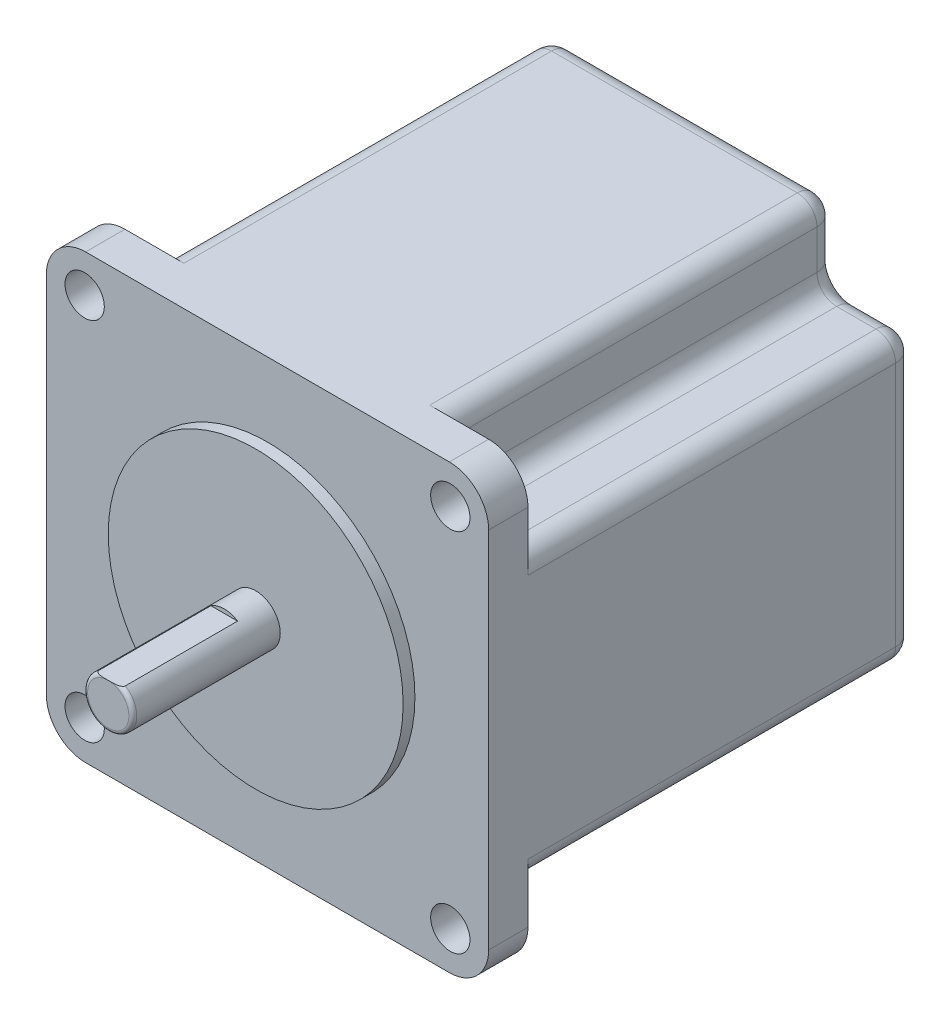
from build123d import *

# Parameters (mm, degrees)
SKETCH1_W           = 57.15
SKETCH1_H           = 57.15
BOSS_EXTRUDE1_DEPTH = 55.118
SKETCH2_R           = 19.05
BOSS_EXTRUDE2_DEPTH = 1.524
SKETCH3_R           = 3.175
BOSS_EXTRUDE3_DEPTH = 19.05
SKETCH18_W          = 20.32
SKETCH18_H          = 20.32
CUT_EXTRUDE13_DEPTH = 50.038
SKETCH20_W          = 20.32
SKETCH20_H          = 20.32
CUT_EXTRUDE14_DEPTH = 50.038
SKETCH21_W          = 20.32
SKETCH21_H          = 20.32
CUT_EXTRUDE15_DEPTH = 50.038
SKETCH22_W          = 20.32
SKETCH22_H          = 20.32
CUT_EXTRUDE16_DEPTH = 50.038
SKETCH11_R          = 2.54
CUT_EXTRUDE8_DEPTH  = 98.827597967
SKETCH12_R          = 2.54
CUT_EXTRUDE9_DEPTH  = 98.827597967
SKETCH14_R          = 2.54
CUT_EXTRUDE10_DEPTH = 98.827597967
SKETCH15_R          = 2.54
CUT_EXTRUDE11_DEPTH = 98.827597967
FILLET2_R           = 5.08
FILLET4_R           = 2.54
FILLET1_R           = 0.508
SKETCH10_W          = 7.148953117
SKETCH10_H          = 1.106198654
CUT_EXTRUDE7_DEPTH  = 14.986


with BuildPart() as part:
    # Sketch1 → Boss-Extrude1 (new body)
    with BuildSketch(Plane.XY):
        with Locations((28.575, 28.575)):
            Rectangle(SKETCH1_W, SKETCH1_H)
    extrude(amount=BOSS_EXTRUDE1_DEPTH)

    # Sketch2 → Boss-Extrude2 (add)
    with BuildSketch(Plane.XY.offset(55.118)):
        with Locations(Location((28.575, 28.575, 0), (0, 0, 180))):
            Circle(SKETCH2_R)
    extrude(amount=BOSS_EXTRUDE2_DEPTH)

    # Sketch3 → Boss-Extrude3 (add)
    with BuildSketch(Plane.XY.offset(56.642)):
        with Locations(Location((28.575, 28.575, 0), (0, 0, 180))):
            Circle(SKETCH3_R)
    extrude(amount=BOSS_EXTRUDE3_DEPTH)

    # Sketch18 → Cut-Extrude13 (cut)
    with BuildSketch(Plane(origin=(0, 0, 0), x_dir=(-1, 0, 0), z_dir=(0, 0, -1))):
        with Locations((0, 57.15)):
            Rectangle(SKETCH18_W, SKETCH18_H)
    extrude(amount=-CUT_EXTRUDE13_DEPTH, mode=Mode.SUBTRACT)

    # Sketch20 → Cut-Extrude14 (cut)
    with BuildSketch(Plane(origin=(0, 0, 0), x_dir=(-1, 0, 0), z_dir=(0, 0, -1))):
        Rectangle(SKETCH20_W, SKETCH20_H)
    extrude(amount=-CUT_EXTRUDE14_DEPTH, mode=Mode.SUBTRACT)

    # Sketch21 → Cut-Extrude15 (cut)
    with BuildSketch(Plane(origin=(0, 0, 0), x_dir=(-1, 0, 0), z_dir=(0, 0, -1))):
        with Locations((-57.15, 0)):
            Rectangle(SKETCH21_W, SKETCH21_H)
    extrude(amount=-CUT_EXTRUDE15_DEPTH, mode=Mode.SUBTRACT)

    # Sketch22 → Cut-Extrude16 (cut)
    with BuildSketch(Plane(origin=(0, 0, 0), x_dir=(-1, 0, 0), z_dir=(0, 0, -1))):
        with Locations((-57.15, 57.15)):
            Rectangle(SKETCH22_W, SKETCH22_H)
    extrude(amount=-CUT_EXTRUDE16_DEPTH, mode=Mode.SUBTRACT)

    # Sketch11 → Cut-Extrude8 (cut, through all)
    with BuildSketch(Plane.XY.offset(55.118)):
        with Locations((4.953, 52.233071325)):
            Circle(SKETCH11_R)
    extrude(amount=-CUT_EXTRUDE8_DEPTH, mode=Mode.SUBTRACT)

    # Sketch12 → Cut-Extrude9 (cut, through all)
    with BuildSketch(Plane.XY.offset(55.118)):
        with Locations((52.197, 52.233071325)):
            Circle(SKETCH12_R)
    extrude(amount=-CUT_EXTRUDE9_DEPTH, mode=Mode.SUBTRACT)

    # Sketch14 → Cut-Extrude10 (cut, through all)
    with BuildSketch(Plane.XY.offset(55.118)):
        with Locations((4.953, 4.989071325)):
            Circle(SKETCH14_R)
    extrude(amount=-CUT_EXTRUDE10_DEPTH, mode=Mode.SUBTRACT)

    # Sketch15 → Cut-Extrude11 (cut, through all)
    with BuildSketch(Plane.XY.offset(55.118)):
        with Locations((52.197, 4.989071325)):
            Circle(SKETCH15_R)
    extrude(amount=-CUT_EXTRUDE11_DEPTH, mode=Mode.SUBTRACT)

    # Fillet2
    fillet2_edges = [part.edges().sort_by_distance(p)[0] for p in [
        (0, 57.15, 52.578),
        (57.15, 57.15, 52.578),
        (57.15, 0, 52.578),
        (0, 0, 52.578),
    ]]
    fillet(fillet2_edges, radius=FILLET2_R)

    # Fillet4
    fillet4_edges = [part.edges().sort_by_distance(p)[0] for p in [
        (0, 28.575, 0),
        (10.16, 52.07, 0),
        (5.08, 46.99, 0),
        (0, 46.99, 25.019),
        (10.16, 57.15, 25.019),
        (10.16, 46.99, 25.019),
        (28.575, 0, 0),
        (5.08, 10.16, 0),
        (10.16, 5.08, 0),
        (10.16, 0, 25.019),
        (0, 10.16, 25.019),
        (10.16, 10.16, 25.019),
        (57.15, 28.575, 0),
        (46.99, 5.08, 0),
        (52.07, 10.16, 0),
        (57.15, 10.16, 25.019),
        (46.99, 0, 25.019),
        (46.99, 10.16, 25.019),
        (28.575, 57.15, 0),
        (52.07, 46.99, 0),
        (46.99, 52.07, 0),
        (46.99, 57.15, 25.019),
        (57.15, 46.99, 25.019),
        (46.99, 46.99, 25.019),
    ]]
    fillet(fillet4_edges, radius=FILLET4_R)

    # Fillet1
    fillet1_edges = [part.edges().sort_by_distance(p)[0] for p in [
        (31.75, 28.575, 75.692),
    ]]
    fillet(fillet1_edges, radius=FILLET1_R)

    # Sketch10 → Cut-Extrude7 (cut)
    with BuildSketch(Plane.XY.offset(75.692)):
        with Locations((29.031069878, 31.795099327)):
            Rectangle(SKETCH10_W, SKETCH10_H)
    extrude(amount=-CUT_EXTRUDE7_DEPTH, mode=Mode.SUBTRACT)


solid = part.part
